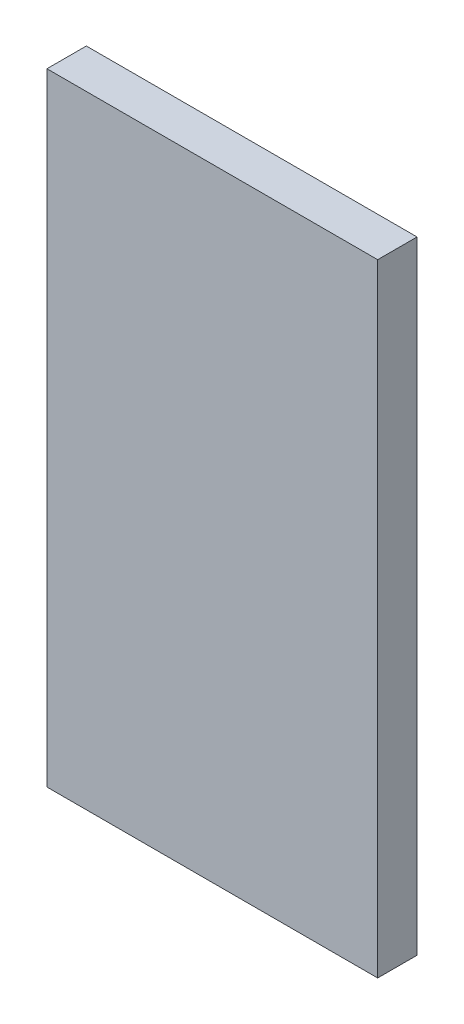
from build123d import *

# Parameters (mm, degrees)
SKETCH1_W           = 84
SKETCH1_H           = 158
BOSS_EXTRUDE1_DEPTH = 10


with BuildPart() as part:
    # Sketch1 → Boss-Extrude1 (new body)
    with BuildSketch(Plane.XY):
        Rectangle(SKETCH1_W, SKETCH1_H)
    extrude(amount=BOSS_EXTRUDE1_DEPTH)


solid = part.part
